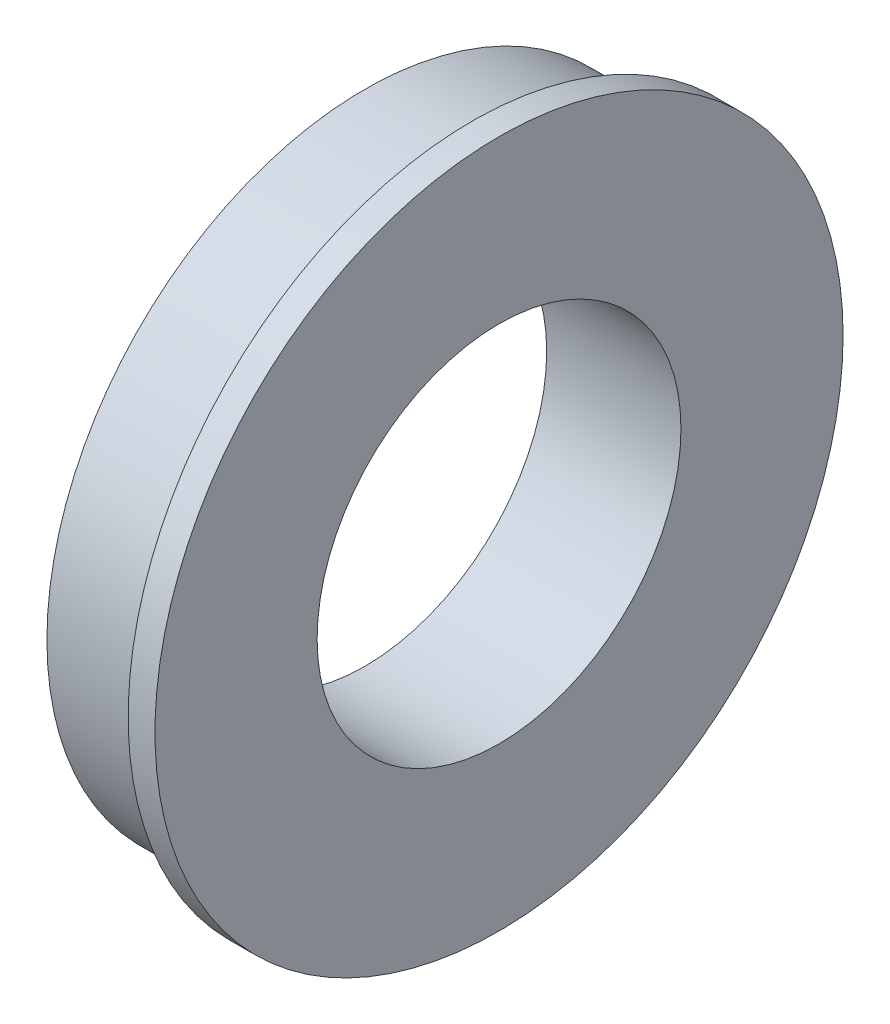
from build123d import *

# Parameters (mm, degrees)
SKETCH1_R           = 47.35
SKETCH1_R_2         = 27.1
BOSS_EXTRUDE1_DEPTH = 16
SKETCH2_R           = 51.25
SKETCH2_R_2         = 27.1
BOSS_EXTRUDE2_DEPTH = 4


with BuildPart() as part:
    # Sketch1 → Boss-Extrude1 (new body)
    with BuildSketch(Plane(origin=(0, 0, 0), x_dir=(0, 0, -1), z_dir=(1, 0, 0))):
        Circle(SKETCH1_R)
        Circle(SKETCH1_R_2, mode=Mode.SUBTRACT)
    extrude(amount=BOSS_EXTRUDE1_DEPTH)

    # Sketch2 → Boss-Extrude2 (add)
    with BuildSketch(Plane(origin=(16, 0, 0), x_dir=(0, 0, -1), z_dir=(1, 0, 0))):
        Circle(SKETCH2_R)
        Circle(SKETCH2_R_2, mode=Mode.SUBTRACT)
    extrude(amount=BOSS_EXTRUDE2_DEPTH)


solid = part.part
